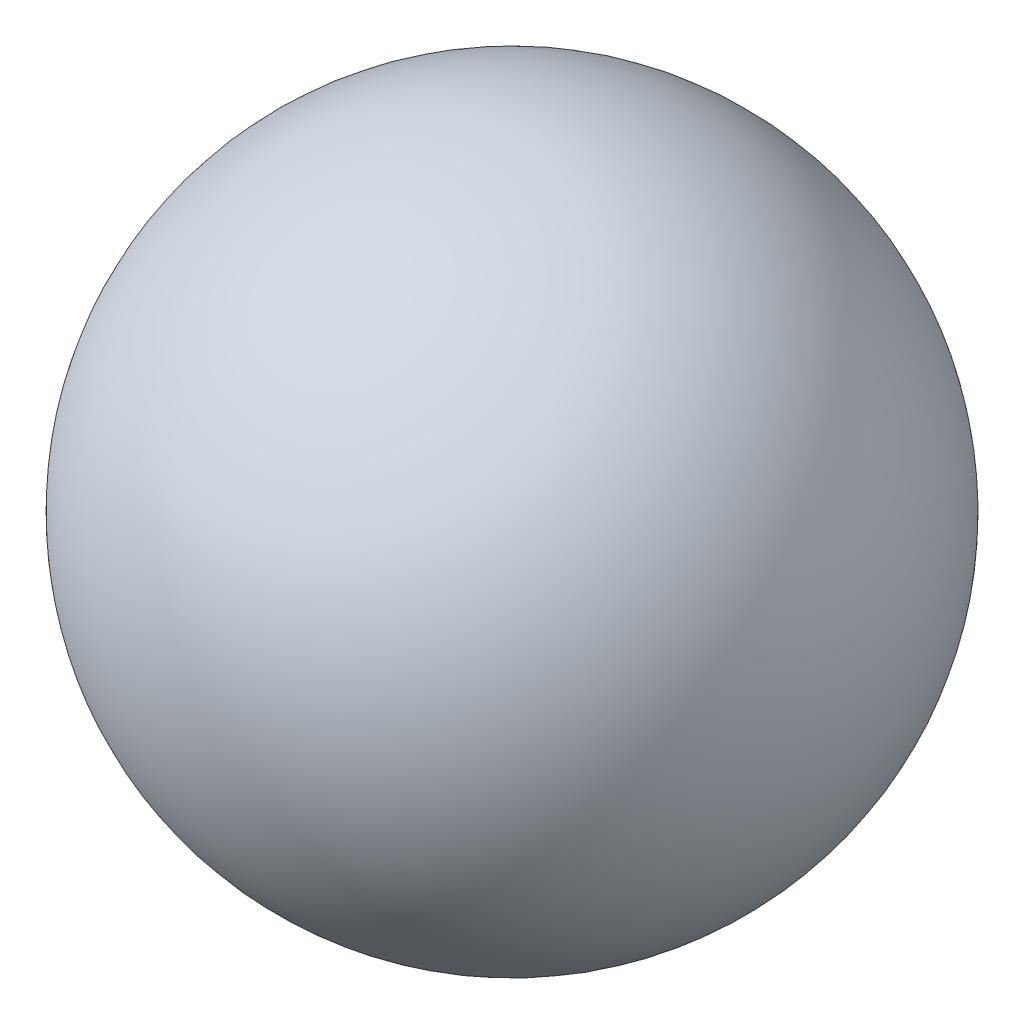
from build123d import *


with BuildPart() as part:
    # Sketch1 → Revolve1 (revolve)
    with BuildSketch(Plane(origin=(0, 0, 0), x_dir=(-1, 0, 0), z_dir=(0, 0, -1))):
        with BuildLine():
            Line((-2.779932675, 1.604994878), (-4.094143968, 2.363755122))
            ThreePointArc((-4.094143968, 2.363755122), (-3.816418443, 1.327269354), (-2.779932675, 1.604994878))
        make_face()
    revolve(axis=Axis((2.615656263, 1.510149848, 0), (0.8660254037844398, 0.499999999999998, 0)))


solid = part.part
